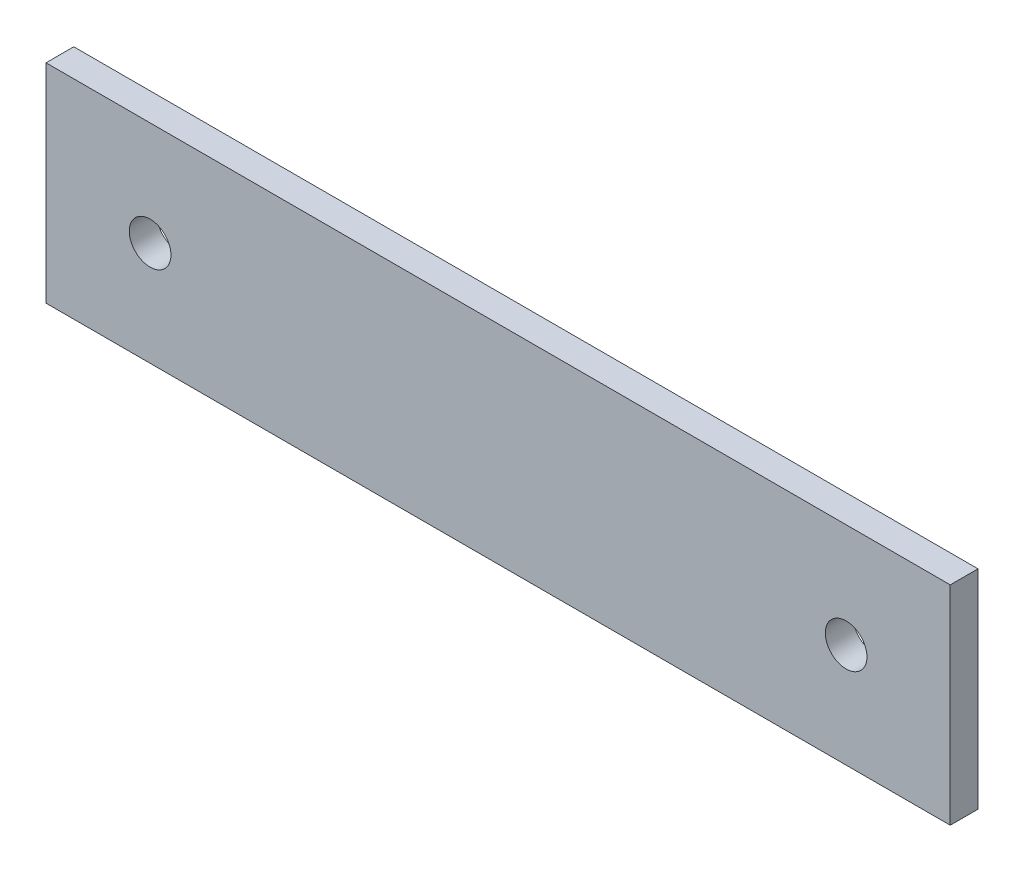
from build123d import *

# Parameters (mm, degrees)
SKETCH_1_W      = 130.3
SKETCH_1_H      = 30
SKETCH_1_R      = 3
EXTRUDE_1_DEPTH = 2


with BuildPart() as part:
    # 草图1 → 凸台-拉伸1 (new, symmetric)
    with BuildSketch(Plane.XY):
        with Locations((50.15, 0)):
            Rectangle(SKETCH_1_W, SKETCH_1_H)
        Circle(SKETCH_1_R, mode=Mode.SUBTRACT)
        with Locations((100.3, 0)):
            Circle(SKETCH_1_R, mode=Mode.SUBTRACT)
    extrude(amount=EXTRUDE_1_DEPTH, both=True)


solid = part.part
